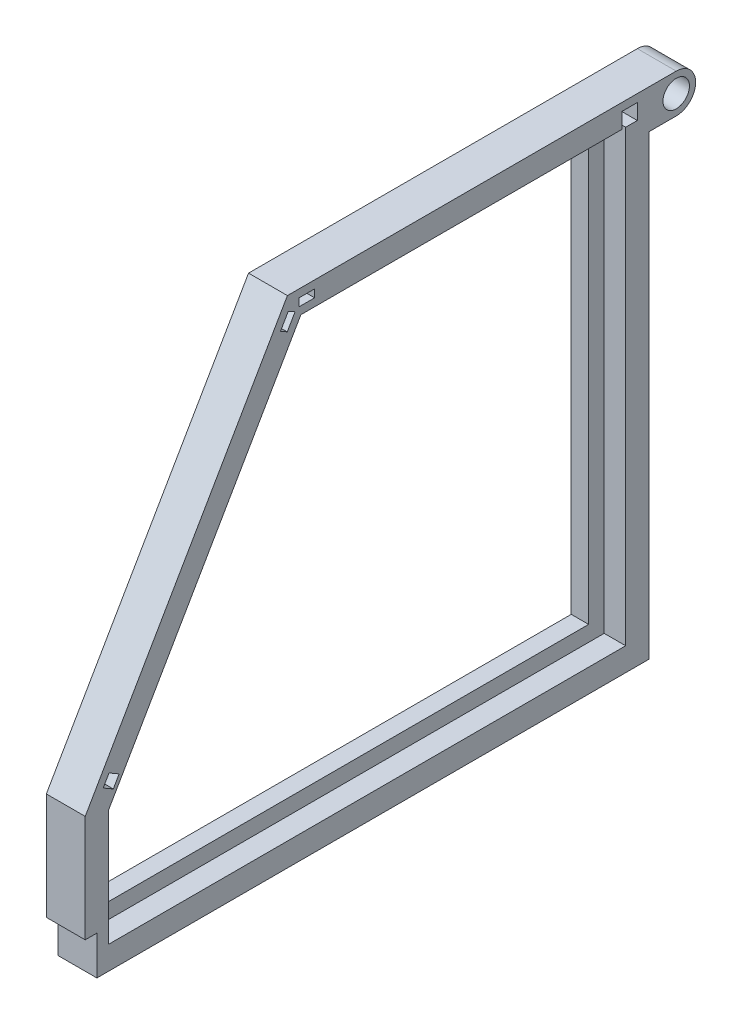
from build123d import *

# Parameters (mm, degrees)
BOSS_EXTRUDE1_DEPTH                             = 5
CSK_FOR_M3_FLAT_HEAD_MACHINE_SCREW1_D           = 3.4
CSK_FOR_M3_FLAT_HEAD_MACHINE_SCREW1_DEPTH       = 10
CSK_FOR_M3_FLAT_HEAD_MACHINE_SCREW1_CSINK_D     = 4.2
CSK_FOR_M3_FLAT_HEAD_MACHINE_SCREW1_CSINK_ANGLE = 90
CSK_FOR_M3_FLAT_HEAD_MACHINE_SCREW1_TIP         = 1.021463052
CUT_EXTRUDE1_DEPTH                              = 2.762
SKETCH9_W                                       = 5
SKETCH9_H                                       = 5
CUT_EXTRUDE3_DEPTH                              = 1.5
SKETCH10_W                                      = 2
SKETCH10_H                                      = 2
CUT_EXTRUDE4_DEPTH                              = 3
CUT_EXTRUDE5_DEPTH                              = 3
CUT_EXTRUDE6_DEPTH                              = 3


with BuildPart() as part:
    # Sketch1 → Boss-Extrude1 (new body)
    with BuildSketch(Plane(origin=(0, 0, 0), x_dir=(0, 0, -1), z_dir=(1, 0, 0))):
        with BuildLine():
            Line((-36.25, 0.243748214), (36.25, 0.243748214))
            Line((36.25, 0.243748214), (36.25, 58.993748214))
            Line((36.25, 58.993748214), (39.75, 58.993748214))
            ThreePointArc((39.75, 58.993748214), (42.25, 61.493748214), (39.75, 63.993748214))
            Line((39.75, 63.993748214), (36.25, 63.993748214))
            Line((36.25, 63.993748214), (-10.25, 63.993748214))
            Line((-10.25, 63.993748214), (-36.25, 18.993748214))
            Line((-36.25, 18.993748214), (-36.25, 0.243748214))
        make_face()
        Polygon((31.25, 5.243748214), (-31.25, 5.243748214), (-31.25, 17.653143244), (-18.920674634, 38.992360224), (-7.364317129, 58.993748214), (31.25, 58.993748214), align=None, mode=Mode.SUBTRACT)
    extrude(amount=BOSS_EXTRUDE1_DEPTH)

    # CSK for M3 Flat Head Machine Screw1
    with Locations(Plane.ZY):
        with Locations((-39.75, 61.493748214)):
            CounterSinkHole(CSK_FOR_M3_FLAT_HEAD_MACHINE_SCREW1_D / 2, CSK_FOR_M3_FLAT_HEAD_MACHINE_SCREW1_CSINK_D / 2, depth=CSK_FOR_M3_FLAT_HEAD_MACHINE_SCREW1_DEPTH, counter_sink_angle=CSK_FOR_M3_FLAT_HEAD_MACHINE_SCREW1_CSINK_ANGLE)
            with Locations((0, 0, -(CSK_FOR_M3_FLAT_HEAD_MACHINE_SCREW1_DEPTH + CSK_FOR_M3_FLAT_HEAD_MACHINE_SCREW1_TIP / 2))):  # 118° drill point
                Cone(0, CSK_FOR_M3_FLAT_HEAD_MACHINE_SCREW1_D / 2, CSK_FOR_M3_FLAT_HEAD_MACHINE_SCREW1_TIP, mode=Mode.SUBTRACT)

    # Sketch6 → Cut-Extrude1 (cut)
    with BuildSketch(Plane(origin=(5, 0, 0), x_dir=(0, 0, -1), z_dir=(1, 0, 0))):
        Polygon((33.25, 60.993748214), (33.25, 3.243748214), (-33.25, 3.243748214), (-33.25, 18.189385232), (-8.518590277, 60.993748214), align=None)
    extrude(amount=-CUT_EXTRUDE1_DEPTH, mode=Mode.SUBTRACT)

    # Sketch9 → Cut-Extrude3 (cut)
    with BuildSketch(Plane.XY.offset(36.25)):
        with Locations((2.5, 2.743748214)):
            Rectangle(SKETCH9_W, SKETCH9_H)
    extrude(amount=-CUT_EXTRUDE3_DEPTH, mode=Mode.SUBTRACT)

    # Sketch10 → Cut-Extrude4 (cut)
    with BuildSketch(Plane(origin=(5, 0, 0), x_dir=(0, 0, -1), z_dir=(1, 0, 0))):
        with Locations((33.75, 61.993748214)):
            Rectangle(SKETCH10_W, SKETCH10_H)
    extrude(amount=-CUT_EXTRUDE4_DEPTH, mode=Mode.SUBTRACT)

    # Sketch13 → Cut-Extrude5 (cut)
    with BuildSketch(Plane(origin=(5, 0, 0), x_dir=(0, 0, -1), z_dir=(1, 0, 0))):
        Polygon((-8.75000025, 62.993748214), (-6.75, 62.993748214), (-6.750000265, 61.993748214), (-8.75000025, 61.993988423), align=None)
        Polygon((-11.135106519, 60.46294286), (-10.134551324, 62.194673006), (-9.26868625, 61.694395408), (-10.269241446, 59.962665262), align=None)
    extrude(amount=-CUT_EXTRUDE5_DEPTH, mode=Mode.SUBTRACT)

    # Sketch15 → Cut-Extrude6 (cut)
    with BuildSketch(Plane(origin=(5, 0, 0), x_dir=(0, 0, -1), z_dir=(1, 0, 0))):
        Polygon((-33.188472136, 22.293656216), (-33.938888532, 20.994858606), (-32.640090922, 20.244442209), (-31.889674526, 21.543239819), align=None)
    extrude(amount=-CUT_EXTRUDE6_DEPTH, mode=Mode.SUBTRACT)


solid = part.part
